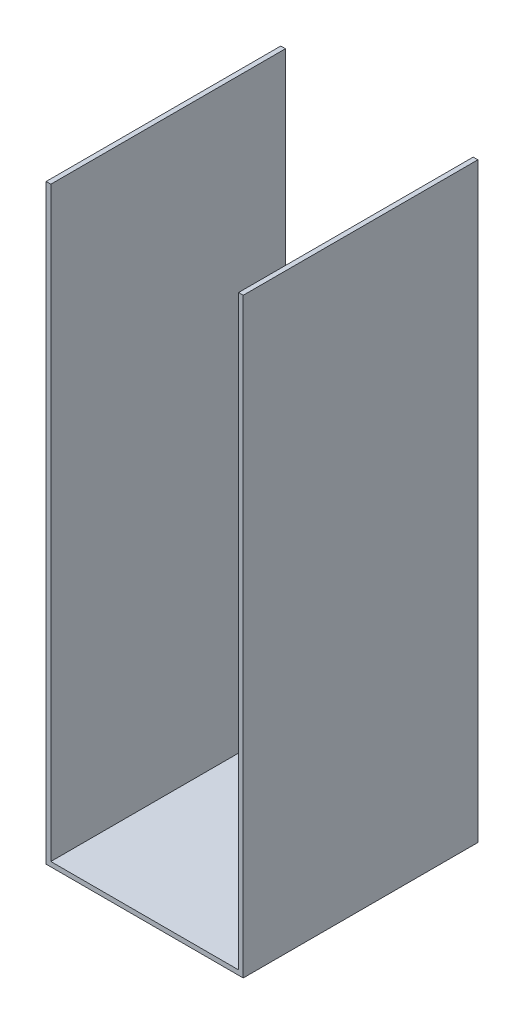
from build123d import *

# Parameters (mm, degrees)
BOSS_EXTRUDE1_DEPTH = 10000


with BuildPart() as part:
    # Sketch2 → Boss-Extrude1 (new body)
    with BuildSketch(Plane.XY):
        Polygon((0, 0), (0, -25000), (8000, -25000), (8000, 0), (8200, 0), (8200, -25200), (-200, -25200), (-200, 0), align=None)
    extrude(amount=-BOSS_EXTRUDE1_DEPTH)


solid = part.part
